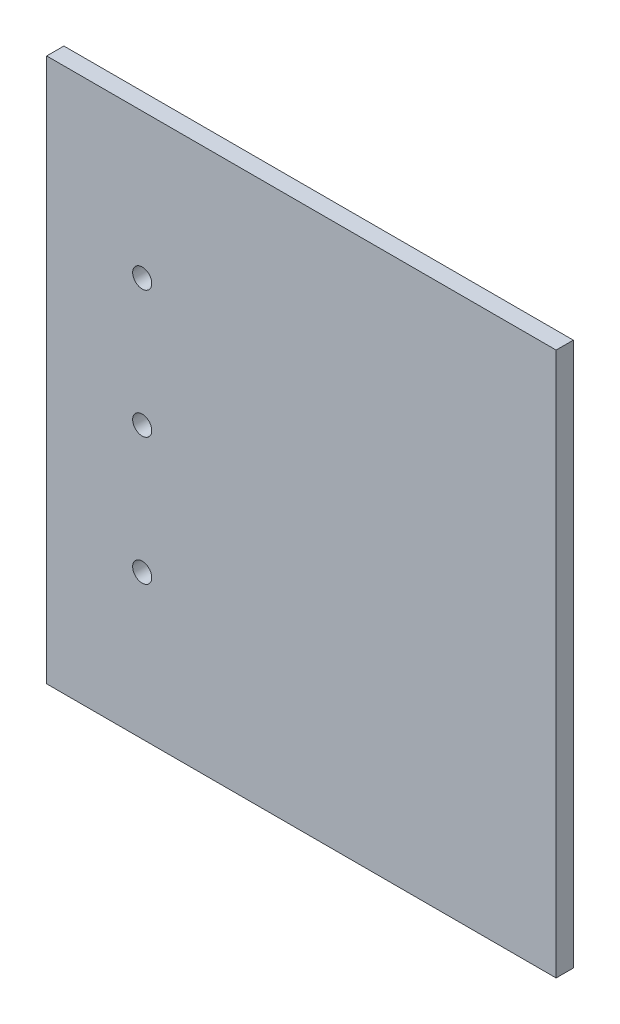
from build123d import *

# Parameters (mm, degrees)
CROQUIS1_W              = 80
CROQUIS1_H              = 85.4
SALIENTE_EXTRUIR1_DEPTH = 2.7
CROQUIS2_R              = 1.5
CORTAR_EXTRUIR1_DEPTH   = 2.7


with BuildPart() as part:
    # Croquis1 → Saliente-Extruir1 (new body)
    with BuildSketch(Plane.XY):
        with Locations((-42.7, 42.7)):
            Rectangle(CROQUIS1_W, CROQUIS1_H)
    extrude(amount=SALIENTE_EXTRUIR1_DEPTH)

    # Croquis2 → Cortar-Extruir1 (cut)
    with BuildSketch(Plane(origin=(0, 0, 0), x_dir=(-1, 0, 0), z_dir=(0, 0, -1))):
        with Locations((67.7, 42.7)):
            Circle(CROQUIS2_R)
        with Locations((67.7, 22.7)):
            Circle(CROQUIS2_R)
        with Locations((67.7, 62.7)):
            Circle(CROQUIS2_R)
    extrude(amount=-CORTAR_EXTRUIR1_DEPTH, mode=Mode.SUBTRACT)


solid = part.part
